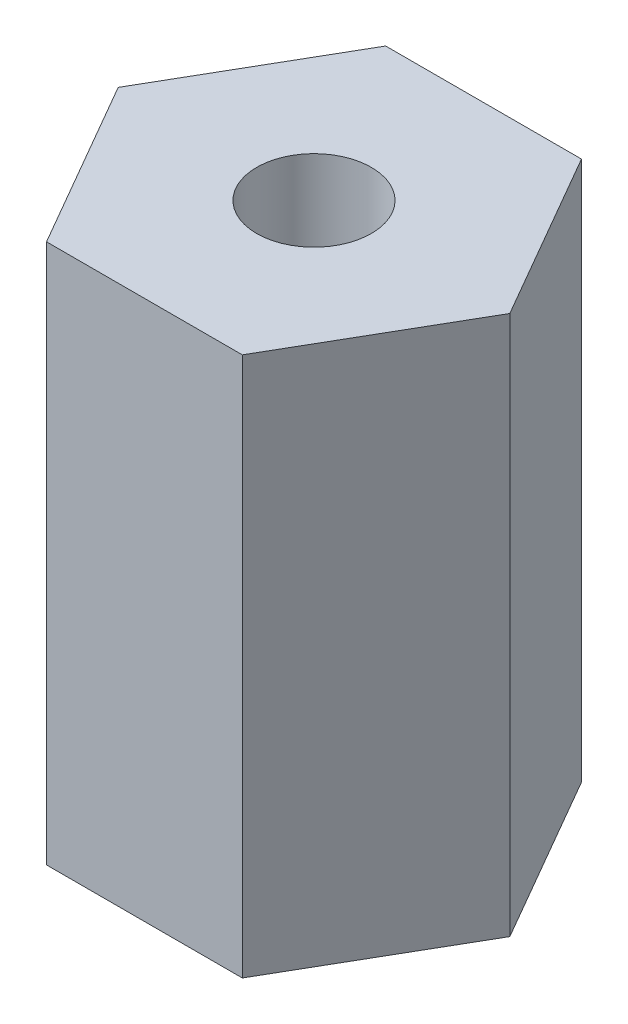
from build123d import *

# Parameters (mm, degrees)
BOSS_EXTRUDE1_DEPTH = 12.73
SKETCH3_R           = 1.35255
CUT_EXTRUDE1_DEPTH  = 6
SKETCH4_R           = 0.353459893
CUT_EXTRUDE2_DEPTH  = 1


with BuildPart() as part:
    # Sketch1 → Boss-Extrude1 (new body)
    with BuildSketch(Plane(origin=(0, 0, 0), x_dir=(1, 0, 0), z_dir=(0, 1, 0))):
        Polygon((-4.618802154, 0), (-2.309401077, -4), (2.309401077, -4), (4.618802154, 0), (2.309401077, 4), (-2.309401077, 4), align=None)
    extrude(amount=BOSS_EXTRUDE1_DEPTH)

    # Sketch3 → Cut-Extrude1 (cut)
    with BuildSketch(Plane(origin=(0, 12.73, 0), x_dir=(1, 0, 0), z_dir=(0, 1, 0))):
        with Locations(Location((0, 0, 0), (0, 0, 270))):
            Circle(SKETCH3_R)
    extrude(amount=-CUT_EXTRUDE1_DEPTH, mode=Mode.SUBTRACT)

    # Sketch4 → Cut-Extrude2 (cut)
    with BuildSketch(Plane.XZ):
        with Locations(Location((0, 0, 0), (0, 0, 270))):
            Circle(SKETCH4_R)
    extrude(amount=-CUT_EXTRUDE2_DEPTH, mode=Mode.SUBTRACT)


solid = part.part
